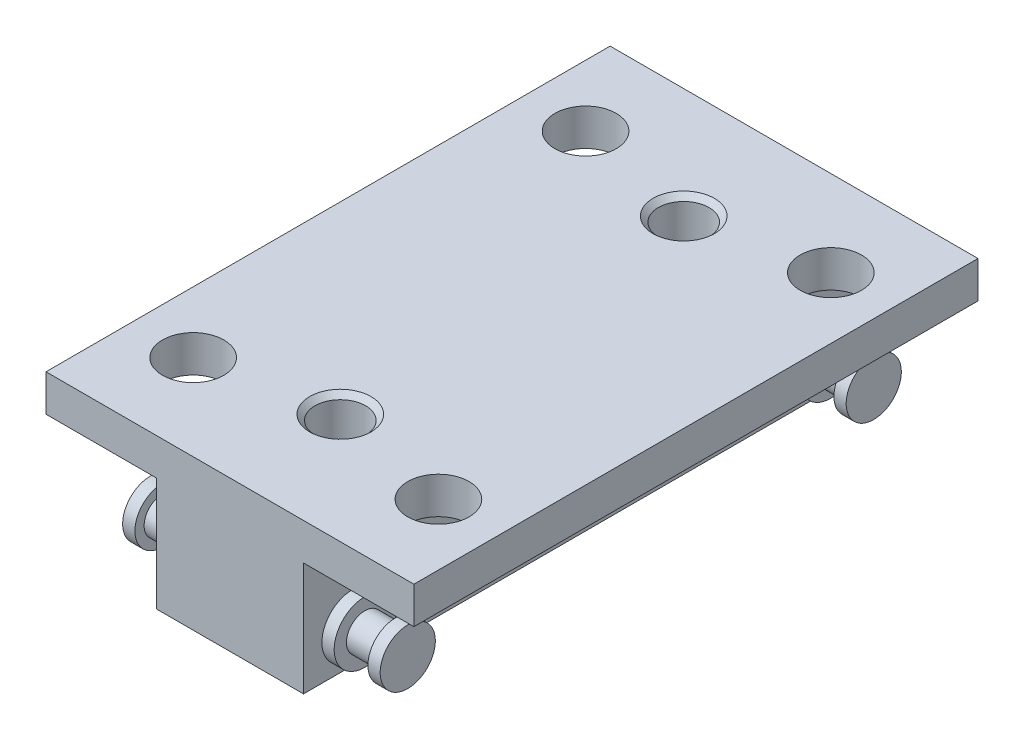
from build123d import *

# Parameters (mm, degrees)
BOSS_EXTRUDE1_DEPTH      = 23
BOSS_EXTRUDE1_DEPTH_BACK = 23
CUT_EXTRUDE1_REACH       = 32.068
SKETCH6_R                = 2.5


with BuildPart() as part:
    # Sketch1 → Boss-Extrude1 (new, two sides: drawn at the far end of the back side and taken through both)
    with BuildSketch(Plane.XY.offset(-BOSS_EXTRUDE1_DEPTH_BACK)):
        Polygon((-15, 6.25), (-15, 3.25), (-6, 3.25), (-6, -6), (6, -6), (6, 3.25), (15, 3.25), (15, 6.25), align=None)
    extrude(amount=BOSS_EXTRUDE1_DEPTH + BOSS_EXTRUDE1_DEPTH_BACK)

    # Sketch2 → Revolve1 (revolve)
    with BuildSketch(Plane.XY.offset(19)):
        Polygon((10.5, -3.125), (10.5, -5.375), (9.5, -5.375), (9.5, -4.625), (7, -4.625), (7, -5.625), (6, -5.625), (6, -4.625), (-6, -4.625), (-6, -5.625), (-7, -5.625), (-7, -4.625), (-9.5, -4.625), (-9.5, -5.375), (-10.5, -5.375), (-10.5, -3.125), align=None)
    revolve(axis=Axis((-10.5, -3.125, 19), (1, 0, 0)))

    # Sketch3 → Revolve2 (revolve)
    with BuildSketch(Plane.XY.offset(-19)):
        Polygon((10.5, -3.125), (10.5, -5.375), (9.5, -5.375), (9.5, -4.625), (7, -4.625), (7, -5.625), (6, -5.625), (6, -4.625), (-6, -4.625), (-6, -5.625), (-7, -5.625), (-7, -4.625), (-9.5, -4.625), (-9.5, -5.375), (-10.5, -5.375), (-10.5, -3.125), align=None)
    revolve(axis=Axis((-10.5, -3.125, -19), (1, 0, 0)))

    # Sketch4 → Cut-Revolve1 (revolve, cut)
    with BuildSketch(Plane(origin=(0, 0, 0), x_dir=(0, 0, -1), z_dir=(1, 0, 0))):
        Polygon((-14, 6.25), (-11.5, 6.25), (-11.933, 5.817), (-11.933, -5.567), (-11.5, -6), (-14, -6), align=None)
    revolve(axis=Axis((0, -6, 14), (0, 1, 0)), mode=Mode.SUBTRACT)

    # Sketch5 → Cut-Revolve2 (revolve, cut)
    with BuildSketch(Plane(origin=(0, 0, 0), x_dir=(0, 0, -1), z_dir=(1, 0, 0))):
        Polygon((14, 6.25), (16.5, 6.25), (16.067, 5.817), (16.067, -5.567), (16.5, -6), (14, -6), align=None)
    revolve(axis=Axis((0, -6, -14), (0, 1, 0)), mode=Mode.SUBTRACT)

    # Sketch6 → Cut-Extrude1 (cut, up to next)
    with BuildSketch(Plane(origin=(0, 6.25, 0), x_dir=(1, 0, 0), z_dir=(0, 1, 0)), mode=Mode.PRIVATE) as cut_extrude1_sk1:
        with Locations((-10, 16)):
            Circle(SKETCH6_R)
    cut_extrude1_tool1 = extrude(cut_extrude1_sk1.sketch, amount=-CUT_EXTRUDE1_REACH, mode=Mode.PRIVATE) & part.part
    # Sketch6 → Cut-Extrude1 (cut, up to next)
    with BuildSketch(Plane(origin=(0, 6.25, 0), x_dir=(1, 0, 0), z_dir=(0, 1, 0)), mode=Mode.PRIVATE) as cut_extrude1_sk2:
        with Locations((10, 16)):
            Circle(SKETCH6_R)
    cut_extrude1_tool2 = extrude(cut_extrude1_sk2.sketch, amount=-CUT_EXTRUDE1_REACH, mode=Mode.PRIVATE) & part.part
    # Sketch6 → Cut-Extrude1 (cut, up to next)
    with BuildSketch(Plane(origin=(0, 6.25, 0), x_dir=(1, 0, 0), z_dir=(0, 1, 0)), mode=Mode.PRIVATE) as cut_extrude1_sk3:
        with Locations((-10, -16)):
            Circle(SKETCH6_R)
    cut_extrude1_tool3 = extrude(cut_extrude1_sk3.sketch, amount=-CUT_EXTRUDE1_REACH, mode=Mode.PRIVATE) & part.part
    # Sketch6 → Cut-Extrude1 (cut, up to next)
    with BuildSketch(Plane(origin=(0, 6.25, 0), x_dir=(1, 0, 0), z_dir=(0, 1, 0)), mode=Mode.PRIVATE) as cut_extrude1_sk4:
        with Locations((10, -16)):
            Circle(SKETCH6_R)
    cut_extrude1_tool4 = extrude(cut_extrude1_sk4.sketch, amount=-CUT_EXTRUDE1_REACH, mode=Mode.PRIVATE) & part.part
    add(cut_extrude1_tool1.solids().sort_by_distance((-10, 6.25, -16))[0], mode=Mode.SUBTRACT)
    add(cut_extrude1_tool2.solids().sort_by_distance((10, 6.25, -16))[0], mode=Mode.SUBTRACT)
    add(cut_extrude1_tool3.solids().sort_by_distance((-10, 6.25, 16))[0], mode=Mode.SUBTRACT)
    add(cut_extrude1_tool4.solids().sort_by_distance((10, 6.25, 16))[0], mode=Mode.SUBTRACT)


solid = part.part
